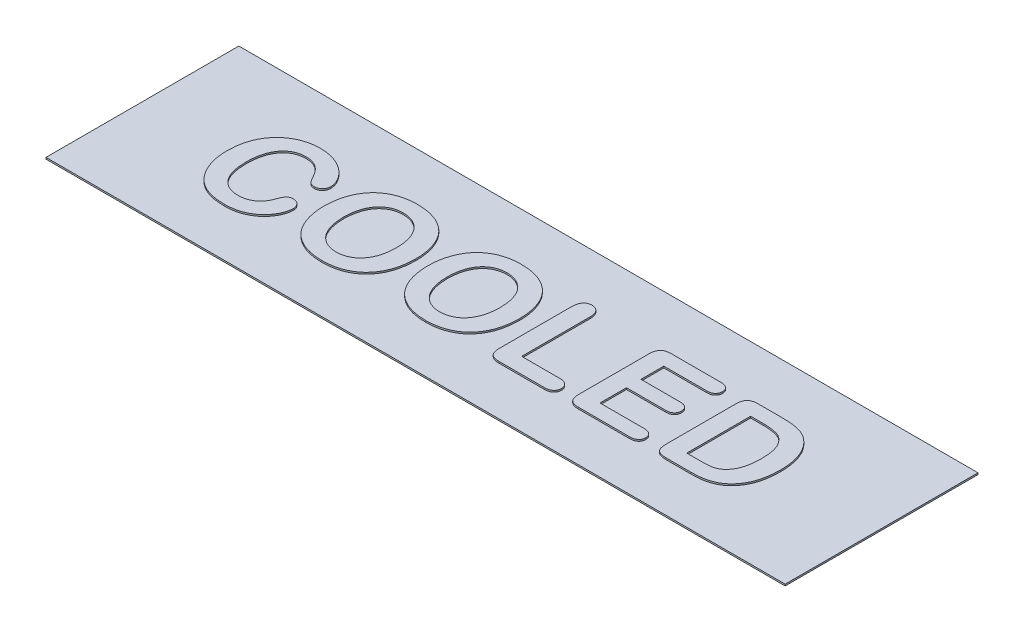
from build123d import *

# Parameters (mm, degrees)
SKETCH1_W             = 46
SKETCH1_H             = 12
BOSS_EXTRUDE1_DEPTH   = 0.1
BOSS_EXTRUDE2_DEPTH   = 0.1
BOSS_EXTRUDE2_2_DEPTH = 0.1
BOSS_EXTRUDE2_3_DEPTH = 0.1
BOSS_EXTRUDE2_4_DEPTH = 0.1
BOSS_EXTRUDE2_5_DEPTH = 0.1
BOSS_EXTRUDE2_6_DEPTH = 0.1


with BuildPart() as part:
    # Sketch1 → Boss-Extrude1 (new body)
    with BuildSketch(Plane(origin=(0, 0, 0), x_dir=(1, 0, 0), z_dir=(0, 1, 0))):
        with Locations((23, 6)):
            Rectangle(SKETCH1_W, SKETCH1_H)
    extrude(amount=-BOSS_EXTRUDE1_DEPTH)


with BuildPart() as body_2:
    # Sketch1<7> → Boss-Extrude2 (new body)
    with BuildSketch(Plane(origin=(0, 0, 0), x_dir=(1, 0, 0), z_dir=(0, 1, 0))):
        with BuildLine():
            Line((25.625, 3.975), (25.625, 8.21015625))
            add(Edge.make_bspline(
                [(25.056640625, 8.925), (25.135269574, 8.926907759), (25.251614069, 8.904358946), (25.38694931, 8.828478386), (25.472674192, 8.749146701), (25.54344568, 8.647516567), (25.612229681, 8.467967013), (25.625271577, 8.315961462), (25.625, 8.21015625)],
                knots=[0, 0, 0, 0, 0.227638752, 0.335766161, 0.446488951, 0.563783129, 0.691981092, 1, 1, 1, 1], degree=3))
            add(Edge.make_bspline(
                [(24.5, 8.21015625), (24.499887175, 8.315085934), (24.512968191, 8.466022479), (24.58115649, 8.643907388), (24.648523622, 8.747083857), (24.733205482, 8.826559912), (24.864422405, 8.905631513), (24.980382614, 8.923897207), (25.056640625, 8.925)],
                knots=[0, 0, 0, 0, 0.308898325, 0.436927057, 0.555088936, 0.666891306, 0.77472238, 1, 1, 1, 1], degree=3))
            Line((24.5, 8.21015625), (24.5, 3.723046875))
            add(Edge.make_bspline(
                [(25.1890625, 3), (25.082830556, 2.998816169), (24.931341204, 3.015415176), (24.754502545, 3.089242067), (24.655995081, 3.167303123), (24.583409327, 3.271355196), (24.512128334, 3.455359003), (24.502162409, 3.613381022), (24.5, 3.723046875)],
                knots=[0, 0, 0, 0, 0.275852089, 0.38874046, 0.492479691, 0.597006627, 0.713774744, 1, 1, 1, 1], degree=3))
            Line((25.1890625, 3), (28.00625, 3))
            add(Edge.make_bspline(
                [(28.595703125, 3.483984375), (28.595855676, 3.417489368), (28.579394392, 3.317105597), (28.512780275, 3.202677582), (28.445660793, 3.129996984), (28.36132429, 3.069974606), (28.214709166, 3.013413186), (28.092069742, 2.998798888), (28.00625, 3)],
                knots=[0, 0, 0, 0, 0.232558164, 0.344107656, 0.456771722, 0.574921473, 0.701248759, 1, 1, 1, 1], degree=3))
            add(Edge.make_bspline(
                [(28.00625, 3.975), (28.091335929, 3.976327288), (28.213772025, 3.961289883), (28.359805365, 3.901280343), (28.444246731, 3.837855322), (28.512228121, 3.763604043), (28.579084209, 3.64925134), (28.595549899, 3.54968334), (28.595703125, 3.483984375)],
                knots=[0, 0, 0, 0, 0.295639848, 0.422720727, 0.544076142, 0.659398281, 0.770687605, 1, 1, 1, 1], degree=3))
            Line((28.00625, 3.975), (25.625, 3.975))
        make_face()
    extrude(amount=BOSS_EXTRUDE2_DEPTH)


with BuildPart() as body_3:
    # Sketch1<7> → Boss-Extrude2 2 (new body)
    with BuildSketch(Plane(origin=(0, 0, 0), x_dir=(1, 0, 0), z_dir=(0, 1, 0))):
        with BuildLine():
            Line((30.575, 7.875), (33.22109375, 7.875))
            add(Edge.make_bspline(
                [(33.775390625, 8.32734375), (33.775773588, 8.264579899), (33.761245453, 8.170288747), (33.700431727, 8.062738343), (33.639599634, 7.994241991), (33.560241465, 7.939564218), (33.421630735, 7.884342893), (33.30287849, 7.877145344), (33.22109375, 7.875)],
                knots=[0, 0, 0, 0, 0.23312118, 0.342370478, 0.452806013, 0.56896429, 0.695252156, 1, 1, 1, 1], degree=3))
            add(Edge.make_bspline(
                [(33.22109375, 8.775), (33.302594366, 8.772195575), (33.422255442, 8.766744358), (33.559953597, 8.709003244), (33.639721459, 8.654717988), (33.699660484, 8.586402875), (33.761770414, 8.481797204), (33.775296333, 8.38873056), (33.775390625, 8.32734375)],
                knots=[0, 0, 0, 0, 0.306655187, 0.434288731, 0.551174014, 0.662300739, 0.7697085, 1, 1, 1, 1], degree=3))
            Line((33.22109375, 8.775), (30.1390625, 8.775))
            add(Edge.make_bspline(
                [(29.45, 8.0578125), (29.450693912, 8.13416374), (29.456528207, 8.244299349), (29.486998454, 8.381448349), (29.518834136, 8.468198914), (29.559501115, 8.54455926), (29.612234981, 8.609185452), (29.675259263, 8.662305605), (29.748049373, 8.705404862), (29.831657417, 8.736215072), (29.961415053, 8.769710059), (30.066820693, 8.773446574), (30.1390625, 8.775)],
                knots=[0, 0, 0, 0, 0.198923952, 0.285459035, 0.364561105, 0.438695517, 0.509487423, 0.580147896, 0.652133435, 0.728383258, 0.811204159, 1, 1, 1, 1], degree=3))
            Line((29.45, 8.0578125), (29.45, 3.7171875))
            add(Edge.make_bspline(
                [(30.1390625, 3), (30.033332644, 3.000296848), (29.880970111, 3.013587041), (29.704965317, 3.088314308), (29.605603595, 3.164855755), (29.533783114, 3.268838684), (29.461863079, 3.451213022), (29.452305314, 3.608411538), (29.45, 3.7171875)],
                knots=[0, 0, 0, 0, 0.276680916, 0.389999231, 0.493501638, 0.598426673, 0.714696995, 1, 1, 1, 1], degree=3))
            Line((30.1390625, 3), (33.3125, 3))
            add(Edge.make_bspline(
                [(33.8703125, 3.446484375), (33.872522376, 3.384865313), (33.853630468, 3.294255844), (33.794072123, 3.187884105), (33.730811083, 3.120816037), (33.65052466, 3.065558889), (33.511414383, 3.011751537), (33.394028069, 3.000371927), (33.3125, 3)],
                knots=[0, 0, 0, 0, 0.227881193, 0.33651993, 0.449574496, 0.567622836, 0.696013188, 1, 1, 1, 1], degree=3))
            add(Edge.make_bspline(
                [(33.3125, 3.9), (33.393426618, 3.897686895), (33.512164331, 3.890913627), (33.65025912, 3.834126283), (33.730820022, 3.779263489), (33.794397865, 3.711911944), (33.854300088, 3.603061758), (33.871973989, 3.509829457), (33.8703125, 3.446484375)],
                knots=[0, 0, 0, 0, 0.301114702, 0.428957738, 0.546002067, 0.658095095, 0.76706378, 1, 1, 1, 1], degree=3))
            Line((33.3125, 3.9), (30.575, 3.9))
            Line((30.575, 3.9), (30.575, 5.55))
            Line((30.575, 5.55), (33.011328125, 5.55))
            add(Edge.make_bspline(
                [(33.545703125, 6.003515625), (33.546232245, 5.94179952), (33.531167392, 5.849795065), (33.474204022, 5.742392505), (33.416126944, 5.673292262), (33.340319924, 5.616891989), (33.206488685, 5.560003506), (33.090941204, 5.551352304), (33.011328125, 5.55)],
                knots=[0, 0, 0, 0, 0.23345114, 0.343651819, 0.45565437, 0.571599419, 0.697114971, 1, 1, 1, 1], degree=3))
            add(Edge.make_bspline(
                [(33.011328125, 6.45), (33.090001897, 6.447975159), (33.204659965, 6.440553228), (33.338004241, 6.38514946), (33.414440245, 6.330747911), (33.473090685, 6.263077606), (33.532305409, 6.157619891), (33.545623224, 6.064934483), (33.545703125, 6.003515625)],
                knots=[0, 0, 0, 0, 0.301571246, 0.427298253, 0.544300415, 0.654763056, 0.765065983, 1, 1, 1, 1], degree=3))
            Line((33.011328125, 6.45), (30.575, 6.45))
            Line((30.575, 6.45), (30.575, 7.875))
        make_face()
    extrude(amount=BOSS_EXTRUDE2_2_DEPTH)


with BuildPart() as body_4:
    # Sketch1<7> → Boss-Extrude2 3 (new body)
    with BuildSketch(Plane(origin=(0, 0, 0), x_dir=(1, 0, 0), z_dir=(0, 1, 0))):
        with BuildLine():
            Line((37.077734375, 8.775), (35.5390625, 8.775))
            add(Edge.make_bspline(
                [(34.85, 8.0578125), (34.850682188, 8.167127664), (34.863925048, 8.323306291), (34.934323021, 8.506461199), (35.008459374, 8.608772111), (35.107440412, 8.685389749), (35.28207052, 8.762069677), (35.434312396, 8.773968362), (35.5390625, 8.775)],
                knots=[0, 0, 0, 0, 0.285971453, 0.402433125, 0.507303748, 0.610976492, 0.724896058, 1, 1, 1, 1], degree=3))
            Line((34.85, 8.0578125), (34.85, 3.823828125))
            add(Edge.make_bspline(
                [(35.591796875, 3), (35.497822538, 2.998579944), (35.36556642, 3.009865932), (35.204172953, 3.048841387), (35.110868171, 3.09196695), (35.035680965, 3.147049594), (34.974541434, 3.211169082), (34.927899052, 3.285267463), (34.89596807, 3.37033331), (34.876562262, 3.466195602), (34.854754283, 3.617914352), (34.850724345, 3.739016252), (34.85, 3.823828125)],
                knots=[0, 0, 0, 0, 0.2152183, 0.303219537, 0.379365002, 0.449245407, 0.51578446, 0.581400495, 0.648611555, 0.722943773, 0.805291853, 1, 1, 1, 1], degree=3))
            Line((35.591796875, 3), (37.117578125, 3))
            add(Edge.make_bspline(
                [(38.93515625, 3.544921875), (38.858589627, 3.478369292), (38.73648301, 3.387777112), (38.562277098, 3.285183047), (38.425914878, 3.219828209), (38.284763385, 3.163707893), (38.139031653, 3.115093213), (37.987805344, 3.076702117), (37.830801596, 3.047318788), (37.666369716, 3.026730721), (37.428185582, 3.005888472), (37.243823991, 3.000444182), (37.117578125, 3)],
                knots=[0, 0, 0, 0, 0.156626632, 0.234241057, 0.311963295, 0.389947415, 0.468751232, 0.549094649, 0.630750543, 0.715321636, 0.804966748, 1, 1, 1, 1], degree=3))
            add(Edge.make_bspline(
                [(39.8, 5.9015625), (39.798815892, 5.734663282), (39.791242302, 5.488566768), (39.750870532, 5.170186147), (39.711388549, 4.947426585), (39.660092218, 4.735825107), (39.595916258, 4.535111789), (39.518058355, 4.345183548), (39.42771331, 4.16589304), (39.325587941, 3.995584602), (39.168818733, 3.781836922), (39.034141702, 3.634482862), (38.93515625, 3.544921875)],
                knots=[0, 0, 0, 0, 0.193525918, 0.28476304, 0.371689637, 0.455567959, 0.536878613, 0.615643256, 0.693176889, 0.7693333, 0.845478947, 1, 1, 1, 1], degree=3))
            add(Edge.make_bspline(
                [(38.887109375, 8.265234375), (38.961989693, 8.199795505), (39.070237831, 8.09718375), (39.199197167, 7.946059668), (39.288083653, 7.826417128), (39.370280865, 7.70080563), (39.445533932, 7.569000477), (39.513950597, 7.430736547), (39.572729485, 7.284821077), (39.627581472, 7.134012818), (39.672237677, 6.976216156), (39.713224523, 6.813191241), (39.74370316, 6.642688), (39.770182374, 6.466575437), (39.793330067, 6.218870655), (39.800127071, 6.029813594), (39.8, 5.9015625)],
                knots=[0, 0, 0, 0, 0.113993314, 0.170501104, 0.22743271, 0.284660868, 0.342396088, 0.401244744, 0.461254627, 0.522552564, 0.585015904, 0.64906269, 0.715076337, 0.783373442, 0.853071398, 1, 1, 1, 1], degree=3))
            add(Edge.make_bspline(
                [(37.077734375, 8.775), (37.26379832, 8.773819892), (37.533342257, 8.76490798), (37.875895231, 8.717429734), (38.104348902, 8.671858762), (38.317456142, 8.605371741), (38.588742514, 8.48748501), (38.772922945, 8.360499579), (38.887109375, 8.265234375)],
                knots=[0, 0, 0, 0, 0.290635926, 0.419883612, 0.539455375, 0.653803964, 0.767645952, 1, 1, 1, 1], degree=3))
        make_face()
        with BuildLine():
            Line((35.975, 3.9), (35.975, 7.875))
            Line((35.975, 7.875), (36.76015625, 7.875))
            add(Edge.make_bspline(
                [(38.6, 5.909765625), (38.601736847, 6.045558056), (38.59206927, 6.242406644), (38.566485828, 6.49536933), (38.536259861, 6.664511565), (38.501433999, 6.820933061), (38.45505677, 6.962771289), (38.403119585, 7.092191468), (38.340207683, 7.207119842), (38.271982549, 7.310390823), (38.200233368, 7.40358636), (38.125039587, 7.487051331), (38.046682561, 7.561791428), (37.962855552, 7.625048641), (37.875817364, 7.679209499), (37.785180672, 7.724771356), (37.655506897, 7.769367969), (37.482193021, 7.811807223), (37.172981476, 7.864264231), (36.928742744, 7.874891314), (36.76015625, 7.875)],
                knots=[0, 0, 0, 0, 0.129300997, 0.187709906, 0.242110265, 0.292941468, 0.340260792, 0.38415347, 0.425623023, 0.464852174, 0.502002638, 0.53758156, 0.571812972, 0.60501508, 0.637446732, 0.669407197, 0.701430455, 0.767873256, 0.839222619, 1, 1, 1, 1], degree=3))
            add(Edge.make_bspline(
                [(38.00234375, 4.175390625), (38.105135205, 4.259699991), (38.236893679, 4.416004063), (38.372503417, 4.65748192), (38.457278663, 4.864418138), (38.520299216, 5.094462498), (38.58520935, 5.443421396), (38.599699172, 5.719544614), (38.6, 5.909765625)],
                knots=[0, 0, 0, 0, 0.209904115, 0.320806578, 0.43797757, 0.563430438, 0.698231978, 1, 1, 1, 1], degree=3))
            add(Edge.make_bspline(
                [(36.876171875, 3.9), (36.964445146, 3.900836108), (37.089139248, 3.900910907), (37.244229414, 3.907391518), (37.369058479, 3.916219859), (37.517634874, 3.94057326), (37.662880919, 3.982690042), (37.777508732, 4.028605239), (37.885275625, 4.083604717), (37.958049153, 4.136695719), (38.00234375, 4.175390625)],
                knots=[0, 0, 0, 0, 0.22318218, 0.315098177, 0.392345338, 0.539419551, 0.694722725, 0.773568962, 0.851294282, 1, 1, 1, 1], degree=3))
            Line((36.876171875, 3.9), (35.975, 3.9))
        make_face(mode=Mode.SUBTRACT)
    extrude(amount=BOSS_EXTRUDE2_3_DEPTH)


with BuildPart() as body_5:
    # Sketch1<7> → Boss-Extrude2 4 (new body)
    with BuildSketch(Plane(origin=(0, 0, 0), x_dir=(1, 0, 0), z_dir=(0, 1, 0))):
        with BuildLine():
            add(Edge.make_bspline(
                [(10.553515625, 4.838671875), (10.554059149, 4.742293287), (10.533849552, 4.594404748), (10.478588179, 4.397254563), (10.418501114, 4.240834064), (10.342032375, 4.081288511), (10.242949659, 3.923566416), (10.125678105, 3.766563483), (9.9891577, 3.612229823), (9.833143379, 3.465729517), (9.65482592, 3.333355898), (9.456747004, 3.21567401), (9.239162245, 3.111984062), (9.002202344, 3.026823325), (8.649017219, 2.946088604), (8.37080444, 2.924283714), (8.18046875, 2.925)],
                knots=[0, 0, 0, 0, 0.085651679, 0.132258731, 0.182153682, 0.234760112, 0.289612587, 0.347798017, 0.409180955, 0.472952001, 0.538097373, 0.606611451, 0.67790349, 0.752531007, 0.83044293, 1, 1, 1, 1], degree=3))
            add(Edge.make_bspline(
                [(10.04375, 5.3578125), (10.110396724, 5.358651622), (10.20925255, 5.3387752), (10.328386417, 5.277017181), (10.405390519, 5.21082331), (10.471647988, 5.133347127), (10.536458743, 5.011594732), (10.553841617, 4.908031308), (10.553515625, 4.838671875)],
                knots=[0, 0, 0, 0, 0.245889437, 0.366954386, 0.493335567, 0.619716748, 0.742738359, 1, 1, 1, 1], degree=3))
            add(Edge.make_bspline(
                [(9.50234375, 4.83046875), (9.525663356, 4.902886213), (9.565380449, 5.005828082), (9.632594458, 5.130311723), (9.684218164, 5.211153535), (9.749896577, 5.278432541), (9.866992699, 5.345729809), (9.972957804, 5.356512965), (10.04375, 5.3578125)],
                knots=[0, 0, 0, 0, 0.277279783, 0.400119537, 0.514929808, 0.625575511, 0.739029446, 1, 1, 1, 1], degree=3))
            add(Edge.make_bspline(
                [(8.1171875, 3.825), (8.198790558, 3.823516614), (8.318635505, 3.833071117), (8.47438823, 3.859638453), (8.583930509, 3.88796107), (8.689501267, 3.922610179), (8.78888888, 3.967917468), (8.884471757, 4.019335852), (8.974918668, 4.07905781), (9.059376506, 4.147669802), (9.13914455, 4.222973276), (9.2148899, 4.304604203), (9.282349001, 4.395935861), (9.346166523, 4.493531214), (9.425291363, 4.636346869), (9.474026858, 4.751159402), (9.50234375, 4.83046875)],
                knots=[0, 0, 0, 0, 0.132859108, 0.19557067, 0.25735061, 0.317159458, 0.376450766, 0.435150932, 0.493964976, 0.552841042, 0.6123065, 0.672705709, 0.734093851, 0.797150419, 0.862713515, 1, 1, 1, 1], degree=3))
            add(Edge.make_bspline(
                [(6.575, 5.876953125), (6.576462495, 5.767162962), (6.579701101, 5.605351847), (6.60047849, 5.395277817), (6.621974015, 5.248403821), (6.646920195, 5.108470748), (6.679815482, 4.976276721), (6.718876227, 4.851198475), (6.762568497, 4.732994682), (6.81416886, 4.622736637), (6.866966145, 4.518011841), (6.926797936, 4.421414133), (6.993451139, 4.333762129), (7.062134766, 4.250733687), (7.137124991, 4.175886734), (7.217365484, 4.108789747), (7.330049346, 4.028911511), (7.482692917, 3.946624475), (7.752345355, 3.849867683), (7.970123372, 3.824932255), (8.1171875, 3.825)],
                knots=[0, 0, 0, 0, 0.113394403, 0.166879264, 0.217803866, 0.266602268, 0.313546111, 0.358312739, 0.401826905, 0.443508869, 0.48390715, 0.522846199, 0.560589315, 0.597504822, 0.634001715, 0.669780949, 0.705359661, 0.776449644, 0.848004704, 1, 1, 1, 1], degree=3))
            add(Edge.make_bspline(
                [(8.15703125, 8.025), (8.041622053, 8.026600254), (7.871757453, 8.00818631), (7.655665877, 7.950364624), (7.506121909, 7.888020995), (7.365072524, 7.809933971), (7.233928631, 7.71256471), (7.112685064, 7.59755104), (7.00012149, 7.46644975), (6.899451583, 7.318709055), (6.812881102, 7.155679183), (6.738312043, 6.979022475), (6.679725921, 6.786655964), (6.630697827, 6.580253577), (6.58767058, 6.275677092), (6.575077749, 6.039029627), (6.575, 5.876953125)],
                knots=[0, 0, 0, 0, 0.115013326, 0.169587365, 0.222730529, 0.276313776, 0.330117835, 0.385279186, 0.442790593, 0.502266545, 0.56331642, 0.626746216, 0.693333725, 0.763788866, 0.838279338, 1, 1, 1, 1], degree=3))
            add(Edge.make_bspline(
                [(9.4625, 7.151953125), (9.391489356, 7.286780362), (9.273621702, 7.476093425), (9.078289625, 7.685500851), (8.926316925, 7.81065637), (8.758663866, 7.9074693), (8.505671608, 8.003512905), (8.297342823, 8.023061472), (8.15703125, 8.025)],
                knots=[0, 0, 0, 0, 0.275111478, 0.398634637, 0.514744822, 0.628615796, 0.746035507, 1, 1, 1, 1], degree=3))
            add(Edge.make_bspline(
                [(10.051953125, 6.669140625), (9.985668211, 6.670450254), (9.888918565, 6.678007618), (9.776658945, 6.726374455), (9.709162121, 6.776357297), (9.651204987, 6.845396893), (9.563355543, 6.968013023), (9.503130518, 7.074697723), (9.4625, 7.151953125)],
                knots=[0, 0, 0, 0, 0.245523862, 0.349026911, 0.445510567, 0.551269408, 0.678784103, 1, 1, 1, 1], degree=3))
            add(Edge.make_bspline(
                [(10.53828125, 7.1765625), (10.536718757, 7.112837206), (10.522413534, 7.014493431), (10.458727508, 6.899792929), (10.39773589, 6.820744617), (10.323671673, 6.75432358), (10.211877387, 6.68817932), (10.115946252, 6.667860411), (10.051953125, 6.669140625)],
                knots=[0, 0, 0, 0, 0.247772361, 0.372488531, 0.502403606, 0.631547353, 0.753790192, 1, 1, 1, 1], degree=3))
            add(Edge.make_bspline(
                [(8.148828125, 8.925), (8.263024156, 8.924189325), (8.432645051, 8.917159313), (8.654228752, 8.886741128), (8.813829741, 8.856275427), (8.968684661, 8.818134348), (9.118459167, 8.769477462), (9.263343708, 8.712457076), (9.402477121, 8.646338883), (9.535667226, 8.575509016), (9.660899044, 8.499080923), (9.778788198, 8.41962288), (9.888016446, 8.334652571), (9.989919964, 8.246387158), (10.082632703, 8.152810642), (10.169034908, 8.057050014), (10.24535302, 7.956294895), (10.314594107, 7.855437268), (10.373216315, 7.753900646), (10.423392336, 7.654415894), (10.466969231, 7.55693654), (10.49811816, 7.459685653), (10.527657065, 7.33392349), (10.538616592, 7.239170743), (10.53828125, 7.1765625)],
                knots=[0, 0, 0, 0, 0.105744288, 0.156825529, 0.206887045, 0.256080655, 0.304331203, 0.352537028, 0.400087593, 0.446834132, 0.492098891, 0.535821229, 0.578344677, 0.620111321, 0.660504904, 0.700198265, 0.73939286, 0.777398795, 0.813365457, 0.847805975, 0.880515907, 0.912072548, 0.94215312, 1, 1, 1, 1], degree=3))
            add(Edge.make_bspline(
                [(5.375, 5.89921875), (5.374453896, 6.122766605), (5.398729328, 6.450629888), (5.483799578, 6.871050769), (5.574379346, 7.159671433), (5.688613676, 7.42945327), (5.823835364, 7.680056142), (5.983920572, 7.909258881), (6.164131133, 8.117884379), (6.363904056, 8.304607705), (6.580141044, 8.468318496), (6.812898057, 8.6074543), (7.060424679, 8.722313534), (7.320270857, 8.811608517), (7.681044, 8.901523757), (7.961266493, 8.924349777), (8.148828125, 8.925)],
                knots=[0, 0, 0, 0, 0.145390458, 0.213116669, 0.278617321, 0.341812555, 0.40344302, 0.463500738, 0.523310125, 0.582457841, 0.641054977, 0.699406973, 0.758524114, 0.818232475, 0.877890528, 1, 1, 1, 1], degree=3))
            add(Edge.make_bspline(
                [(6.096875, 3.737109375), (6.020454367, 3.83005512), (5.910038229, 3.975214168), (5.787255009, 4.186183806), (5.699213932, 4.350882199), (5.624069429, 4.524624853), (5.557033279, 4.703597679), (5.500294101, 4.888631), (5.455355502, 5.079835522), (5.4181509, 5.276362519), (5.386646429, 5.549969619), (5.372966842, 5.758206762), (5.375, 5.89921875)],
                knots=[0, 0, 0, 0, 0.155267269, 0.234285817, 0.314470213, 0.395866073, 0.478081763, 0.560751105, 0.64514612, 0.731170346, 0.818423761, 1, 1, 1, 1], degree=3))
            add(Edge.make_bspline(
                [(8.18046875, 2.925), (8.034468154, 2.923419904), (7.820073, 2.935115649), (7.542056284, 2.969437085), (7.348085968, 3.005300892), (7.163712233, 3.053820565), (6.988329039, 3.113462169), (6.820557005, 3.183672773), (6.661745367, 3.2671824), (6.510412997, 3.364534004), (6.314427738, 3.513089783), (6.179973053, 3.642994434), (6.096875, 3.737109375)],
                knots=[0, 0, 0, 0, 0.18942103, 0.278348977, 0.363474898, 0.445259908, 0.525592284, 0.603755942, 0.681096262, 0.758173524, 0.837070514, 1, 1, 1, 1], degree=3))
        make_face()
    extrude(amount=BOSS_EXTRUDE2_4_DEPTH)


with BuildPart() as body_6:
    # Sketch1<7> → Boss-Extrude2 5 (new body)
    with BuildSketch(Plane(origin=(0, 0, 0), x_dir=(1, 0, 0), z_dir=(0, 1, 0))):
        with BuildLine():
            add(Edge.make_bspline(
                [(14.205078125, 8.925), (14.350705823, 8.925517693), (14.565643278, 8.913396271), (14.845968732, 8.875844033), (15.044913172, 8.836305747), (15.235605029, 8.784638704), (15.418081204, 8.721157414), (15.592576685, 8.646052544), (15.75929559, 8.560802706), (15.916406491, 8.464299865), (16.064909706, 8.358769096), (16.203123169, 8.242662108), (16.33136906, 8.116998112), (16.448829148, 7.981434222), (16.557211062, 7.836723147), (16.655679893, 7.682050861), (16.743175204, 7.517450233), (16.821783534, 7.345380719), (16.890021935, 7.165338025), (16.946972177, 6.978084851), (16.994358756, 6.78331124), (17.030210755, 6.581301399), (17.064711052, 6.297479724), (17.076458834, 6.08036824), (17.075, 5.933203125)],
                knots=[0, 0, 0, 0, 0.09290419, 0.137184365, 0.180402047, 0.222249244, 0.263166145, 0.303591048, 0.343393181, 0.382555505, 0.421155233, 0.459552383, 0.497628553, 0.535618942, 0.573909126, 0.612912447, 0.652504814, 0.692776471, 0.733565596, 0.775279675, 0.817603073, 0.861416259, 0.906126593, 1, 1, 1, 1], degree=3))
            add(Edge.make_bspline(
                [(11.375, 5.94140625), (11.37433099, 6.155871324), (11.397137614, 6.472180049), (11.477829514, 6.880193912), (11.562069133, 7.166181245), (11.669012956, 7.43525463), (11.798786808, 7.684478205), (11.949045862, 7.913079803), (12.120775266, 8.120624415), (12.314250081, 8.305847903), (12.528387377, 8.467836325), (12.762132908, 8.607174339), (13.015498703, 8.721806364), (13.287326866, 8.813719082), (13.683413157, 8.902776356), (13.994140005, 8.924779968), (14.205078125, 8.925)],
                knots=[0, 0, 0, 0, 0.1382864, 0.203793864, 0.267878392, 0.33027928, 0.390220103, 0.44876799, 0.506371847, 0.563562784, 0.621098302, 0.679160794, 0.738680923, 0.800098348, 0.863897564, 1, 1, 1, 1], degree=3))
            add(Edge.make_bspline(
                [(14.228515625, 2.925), (14.011971852, 2.925438171), (13.693412037, 2.949948196), (13.286643972, 3.041997294), (13.006902734, 3.138057704), (12.748023663, 3.260519293), (12.50892503, 3.4030325), (12.294244713, 3.571394893), (12.101225286, 3.76079172), (11.929882597, 3.971524039), (11.784212885, 4.204635743), (11.655750093, 4.455053237), (11.554185841, 4.726491539), (11.473470471, 5.013059311), (11.396121846, 5.417963644), (11.375602585, 5.730604927), (11.375, 5.94140625)],
                knots=[0, 0, 0, 0, 0.138272462, 0.202995678, 0.265765681, 0.326669967, 0.385513394, 0.443074862, 0.500381379, 0.55782282, 0.615999948, 0.675549741, 0.737188733, 0.800657159, 0.865405829, 1, 1, 1, 1], degree=3))
            add(Edge.make_bspline(
                [(17.075, 5.933203125), (17.073935821, 5.718618337), (17.055190331, 5.402133814), (16.976342647, 4.995254636), (16.897746287, 4.711199433), (16.794342777, 4.444347309), (16.668564976, 4.195054047), (16.519149939, 3.964521643), (16.347713983, 3.752958632), (16.154910888, 3.561564161), (15.939423937, 3.394709898), (15.702589169, 3.252308362), (15.44651089, 3.132326269), (15.169653292, 3.037927557), (14.763493667, 2.95045377), (14.445714348, 2.92275435), (14.228515625, 2.925)],
                knots=[0, 0, 0, 0, 0.137311395, 0.201923683, 0.264709882, 0.32551993, 0.384611366, 0.442945715, 0.500835072, 0.558413216, 0.616268615, 0.674654277, 0.734770427, 0.796775233, 0.861253652, 1, 1, 1, 1], degree=3))
        make_face()
        with BuildLine():
            add(Edge.make_bspline(
                [(15.875, 5.94140625), (15.875001852, 6.143395773), (15.853203564, 6.438705725), (15.76518804, 6.811812479), (15.689340389, 7.021874696), (15.616432809, 7.177585462), (15.556897912, 7.285960277), (15.492853721, 7.387990075), (15.420165554, 7.480275568), (15.344765521, 7.567218798), (15.263131524, 7.646770699), (15.175121491, 7.717742512), (15.051789278, 7.80390108), (14.885707041, 7.893063159), (14.595443922, 7.997149743), (14.362125631, 8.025181047), (14.205078125, 8.025)],
                knots=[0, 0, 0, 0, 0.201340022, 0.293362994, 0.381131142, 0.423257805, 0.464531136, 0.504254677, 0.543093542, 0.581420249, 0.618845449, 0.656464354, 0.693921907, 0.768612319, 0.843448556, 1, 1, 1, 1], degree=3))
            add(Edge.make_bspline(
                [(14.221484375, 3.825), (14.367353637, 3.823863615), (14.585186387, 3.852898598), (14.859267083, 3.94984619), (15.020901748, 4.032341694), (15.142722621, 4.113731762), (15.230754589, 4.182381067), (15.312593396, 4.260505098), (15.390600694, 4.345083079), (15.462884681, 4.437960617), (15.531322832, 4.537959475), (15.594510072, 4.646148811), (15.652969282, 4.761923712), (15.705761857, 4.885073567), (15.751809671, 5.015271333), (15.788516211, 5.153089348), (15.820560025, 5.29724781), (15.844908976, 5.448694492), (15.868631746, 5.663813608), (15.875056225, 5.829177534), (15.875, 5.94140625)],
                knots=[0, 0, 0, 0, 0.144678921, 0.215803765, 0.287769109, 0.324116549, 0.361115773, 0.39841849, 0.436289159, 0.475226541, 0.515125013, 0.55648686, 0.599489885, 0.643782778, 0.689399935, 0.736430415, 0.785256624, 0.835932137, 0.88859773, 1, 1, 1, 1], degree=3))
            add(Edge.make_bspline(
                [(12.575, 5.94140625), (12.575424028, 5.781631611), (12.589455202, 5.546620455), (12.641977193, 5.243907756), (12.69513474, 5.034341099), (12.763980254, 4.839798309), (12.84660799, 4.662063711), (12.939241462, 4.499869148), (13.048520784, 4.357737128), (13.166560925, 4.232312874), (13.293419272, 4.123067996), (13.428180011, 4.030007113), (13.57213543, 3.95423114), (13.724489526, 3.897432416), (13.939163964, 3.83905565), (14.108118704, 3.825694229), (14.221484375, 3.825)],
                knots=[0, 0, 0, 0, 0.159003827, 0.2335697, 0.305398243, 0.373867728, 0.438552927, 0.500211032, 0.55928691, 0.616472439, 0.671315987, 0.725540487, 0.779083807, 0.832714508, 0.887015558, 1, 1, 1, 1], degree=3))
            add(Edge.make_bspline(
                [(14.205078125, 8.025), (14.09140395, 8.025704353), (13.922656966, 8.00877522), (13.706646307, 7.951824008), (13.553650014, 7.893145056), (13.409338333, 7.818101431), (13.274357415, 7.727020843), (13.150334802, 7.620228171), (13.036576253, 7.498163827), (12.933761864, 7.359595666), (12.842545463, 7.203086893), (12.763072443, 7.028635321), (12.695303954, 6.837797235), (12.641764178, 6.631555383), (12.589544179, 6.332285596), (12.575368894, 6.099634923), (12.575, 5.94140625)],
                knots=[0, 0, 0, 0, 0.114495858, 0.169875428, 0.224703832, 0.279284384, 0.333437404, 0.388430893, 0.443856612, 0.50125054, 0.561944676, 0.626059285, 0.694164421, 0.765773197, 0.840522227, 1, 1, 1, 1], degree=3))
        make_face(mode=Mode.SUBTRACT)
    extrude(amount=BOSS_EXTRUDE2_5_DEPTH)


with BuildPart() as body_7:
    # Sketch1<7> → Boss-Extrude2 6 (new body)
    with BuildSketch(Plane(origin=(0, 0, 0), x_dir=(1, 0, 0), z_dir=(0, 1, 0))):
        with BuildLine():
            add(Edge.make_bspline(
                [(20.655078125, 8.925), (20.800705823, 8.925517693), (21.015643278, 8.913396271), (21.295968732, 8.875844033), (21.494913172, 8.836305747), (21.685605029, 8.784638704), (21.868081204, 8.721157414), (22.042576685, 8.646052544), (22.20929559, 8.560802706), (22.366406491, 8.464299865), (22.514909706, 8.358769096), (22.653123169, 8.242662108), (22.78136906, 8.116998112), (22.898829148, 7.981434222), (23.007211062, 7.836723147), (23.105679893, 7.682050861), (23.193175204, 7.517450233), (23.271783534, 7.345380719), (23.340021935, 7.165338025), (23.396972177, 6.978084851), (23.444358756, 6.78331124), (23.480210755, 6.581301399), (23.514711052, 6.297479724), (23.526458834, 6.08036824), (23.525, 5.933203125)],
                knots=[0, 0, 0, 0, 0.09290419, 0.137184365, 0.180402047, 0.222249244, 0.263166145, 0.303591048, 0.343393181, 0.382555505, 0.421155233, 0.459552383, 0.497628553, 0.535618942, 0.573909126, 0.612912447, 0.652504814, 0.692776471, 0.733565596, 0.775279675, 0.817603073, 0.861416259, 0.906126593, 1, 1, 1, 1], degree=3))
            add(Edge.make_bspline(
                [(17.825, 5.94140625), (17.82433099, 6.155871324), (17.847137614, 6.472180049), (17.927829514, 6.880193912), (18.012069133, 7.166181245), (18.119012956, 7.43525463), (18.248786808, 7.684478205), (18.399045862, 7.913079803), (18.570775266, 8.120624415), (18.764250081, 8.305847903), (18.978387377, 8.467836325), (19.212132908, 8.607174339), (19.465498703, 8.721806364), (19.737326866, 8.813719082), (20.133413157, 8.902776356), (20.444140005, 8.924779968), (20.655078125, 8.925)],
                knots=[0, 0, 0, 0, 0.1382864, 0.203793864, 0.267878392, 0.33027928, 0.390220103, 0.44876799, 0.506371847, 0.563562784, 0.621098302, 0.679160794, 0.738680923, 0.800098348, 0.863897564, 1, 1, 1, 1], degree=3))
            add(Edge.make_bspline(
                [(20.678515625, 2.925), (20.461971852, 2.925438171), (20.143412037, 2.949948196), (19.736643972, 3.041997294), (19.456902734, 3.138057704), (19.198023663, 3.260519293), (18.95892503, 3.4030325), (18.744244713, 3.571394893), (18.551225286, 3.76079172), (18.379882597, 3.971524039), (18.234212885, 4.204635743), (18.105750093, 4.455053237), (18.004185841, 4.726491539), (17.923470471, 5.013059311), (17.846121846, 5.417963644), (17.825602585, 5.730604927), (17.825, 5.94140625)],
                knots=[0, 0, 0, 0, 0.138272462, 0.202995678, 0.265765681, 0.326669967, 0.385513394, 0.443074862, 0.500381379, 0.55782282, 0.615999948, 0.675549741, 0.737188733, 0.800657159, 0.865405829, 1, 1, 1, 1], degree=3))
            add(Edge.make_bspline(
                [(23.525, 5.933203125), (23.523935821, 5.718618337), (23.505190331, 5.402133814), (23.426342647, 4.995254636), (23.347746287, 4.711199433), (23.244342777, 4.444347309), (23.118564976, 4.195054047), (22.969149939, 3.964521643), (22.797713983, 3.752958632), (22.604910888, 3.561564161), (22.389423937, 3.394709898), (22.152589169, 3.252308362), (21.89651089, 3.132326269), (21.619653292, 3.037927557), (21.213493667, 2.95045377), (20.895714348, 2.92275435), (20.678515625, 2.925)],
                knots=[0, 0, 0, 0, 0.137311395, 0.201923683, 0.264709882, 0.32551993, 0.384611366, 0.442945715, 0.500835072, 0.558413216, 0.616268615, 0.674654277, 0.734770427, 0.796775233, 0.861253652, 1, 1, 1, 1], degree=3))
        make_face()
        with BuildLine():
            add(Edge.make_bspline(
                [(22.325, 5.94140625), (22.325001852, 6.143395773), (22.303203564, 6.438705725), (22.21518804, 6.811812479), (22.139340389, 7.021874696), (22.066432809, 7.177585462), (22.006897912, 7.285960277), (21.942853721, 7.387990075), (21.870165554, 7.480275568), (21.794765521, 7.567218798), (21.713131524, 7.646770699), (21.625121491, 7.717742512), (21.501789278, 7.80390108), (21.335707041, 7.893063159), (21.045443922, 7.997149743), (20.812125631, 8.025181047), (20.655078125, 8.025)],
                knots=[0, 0, 0, 0, 0.201340022, 0.293362994, 0.381131142, 0.423257805, 0.464531136, 0.504254677, 0.543093542, 0.581420249, 0.618845449, 0.656464354, 0.693921907, 0.768612319, 0.843448556, 1, 1, 1, 1], degree=3))
            add(Edge.make_bspline(
                [(20.671484375, 3.825), (20.817353637, 3.823863615), (21.035186387, 3.852898598), (21.309267083, 3.94984619), (21.470901748, 4.032341694), (21.592722621, 4.113731762), (21.680754589, 4.182381067), (21.762593396, 4.260505098), (21.840600694, 4.345083079), (21.912884681, 4.437960617), (21.981322832, 4.537959475), (22.044510072, 4.646148811), (22.102969282, 4.761923712), (22.155761857, 4.885073567), (22.201809671, 5.015271333), (22.238516211, 5.153089348), (22.270560025, 5.29724781), (22.294908976, 5.448694492), (22.318631746, 5.663813608), (22.325056225, 5.829177534), (22.325, 5.94140625)],
                knots=[0, 0, 0, 0, 0.144678921, 0.215803765, 0.287769109, 0.324116549, 0.361115773, 0.39841849, 0.436289159, 0.475226541, 0.515125013, 0.55648686, 0.599489885, 0.643782778, 0.689399935, 0.736430415, 0.785256624, 0.835932137, 0.88859773, 1, 1, 1, 1], degree=3))
            add(Edge.make_bspline(
                [(19.025, 5.94140625), (19.025424028, 5.781631611), (19.039455202, 5.546620455), (19.091977193, 5.243907756), (19.14513474, 5.034341099), (19.213980254, 4.839798309), (19.29660799, 4.662063711), (19.389241462, 4.499869148), (19.498520784, 4.357737128), (19.616560925, 4.232312874), (19.743419272, 4.123067996), (19.878180011, 4.030007113), (20.02213543, 3.95423114), (20.174489526, 3.897432416), (20.389163964, 3.83905565), (20.558118704, 3.825694229), (20.671484375, 3.825)],
                knots=[0, 0, 0, 0, 0.159003827, 0.2335697, 0.305398243, 0.373867728, 0.438552927, 0.500211032, 0.55928691, 0.616472439, 0.671315987, 0.725540487, 0.779083807, 0.832714508, 0.887015558, 1, 1, 1, 1], degree=3))
            add(Edge.make_bspline(
                [(20.655078125, 8.025), (20.54140395, 8.025704353), (20.372656966, 8.00877522), (20.156646307, 7.951824008), (20.003650014, 7.893145056), (19.859338333, 7.818101431), (19.724357415, 7.727020843), (19.600334802, 7.620228171), (19.486576253, 7.498163827), (19.383761864, 7.359595666), (19.292545463, 7.203086893), (19.213072443, 7.028635321), (19.145303954, 6.837797235), (19.091764178, 6.631555383), (19.039544179, 6.332285596), (19.025368894, 6.099634923), (19.025, 5.94140625)],
                knots=[0, 0, 0, 0, 0.114495858, 0.169875428, 0.224703832, 0.279284384, 0.333437404, 0.388430893, 0.443856612, 0.50125054, 0.561944676, 0.626059285, 0.694164421, 0.765773197, 0.840522227, 1, 1, 1, 1], degree=3))
        make_face(mode=Mode.SUBTRACT)
    extrude(amount=BOSS_EXTRUDE2_6_DEPTH)


solid = Compound([part.part, body_2.part, body_3.part, body_4.part, body_5.part, body_6.part, body_7.part])
